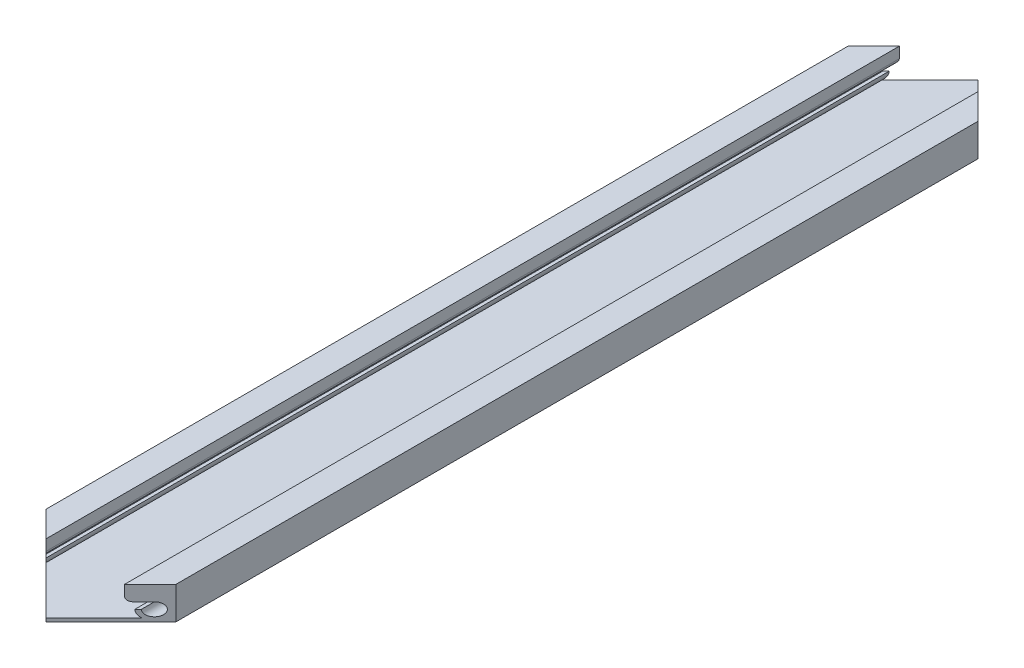
from build123d import *

# Parameters (mm, degrees)
SKETCH_1_W          = 60
SKETCH_1_H          = 15
EXTRUDE_1_DEPTH     = 430
SKETCH_2_R          = 3
CUT_EXTRUDE_1_DEPTH = 432.110484679
CUT_EXTRUDE_2_DEPTH = 432.110484679
SKETCH_4_W          = 36.3
SKETCH_4_H          = 7
CUT_EXTRUDE_3_DEPTH = 432.110484679
FILLET_1_R          = 2
CUT_EXTRUDE_4_DEPTH = 432.306155764


with BuildPart() as part:
    # 스케치1 → 보스-돌출1 (new body)
    with BuildSketch(Plane.XY):
        Rectangle(SKETCH_1_W, SKETCH_1_H)
    extrude(amount=EXTRUDE_1_DEPTH)

    # 스케치2 → 컷-돌출1 (cut, through all)
    with BuildSketch(Plane(origin=(0, 0, 0), x_dir=(-1, 0, 0), z_dir=(0, 0, -1))):
        with Locations((-25, -2.5)):
            Circle(SKETCH_2_R)
        with Locations((25, -2.5)):
            Circle(SKETCH_2_R)
    extrude(amount=-CUT_EXTRUDE_1_DEPTH, mode=Mode.SUBTRACT)

    # 스케치3 → 컷-돌출2 (cut, through all)
    with BuildSketch(Plane(origin=(0, 0, 0), x_dir=(-1, 0, 0), z_dir=(0, 0, -1))):
        with BuildLine():
            Line((-22.171572875, -6), (22.171572875, -6))
            ThreePointArc((22.171572875, -6), (20.939339828, -4.439339828), (20.5, -2.5))
            Line((20.5, -2.5), (25, -2.5))
            Line((25, -2.5), (25, 0.5))
            Line((25, 0.5), (-25, 0.5))
            Line((-25, 0.5), (-25, -2.5))
            Line((-25, -2.5), (-20.5, -2.5))
            ThreePointArc((-20.5, -2.5), (-20.939339828, -4.439339828), (-22.171572875, -6))
        make_face()
    extrude(amount=-CUT_EXTRUDE_2_DEPTH, mode=Mode.SUBTRACT)

    # 스케치4 → 컷-돌출3 (cut, through all)
    with BuildSketch(Plane(origin=(0, 0, 0), x_dir=(-1, 0, 0), z_dir=(0, 0, -1))):
        with Locations((0.006888359, 4)):
            Rectangle(SKETCH_4_W, SKETCH_4_H)
    extrude(amount=-CUT_EXTRUDE_3_DEPTH, mode=Mode.SUBTRACT)

    # 필렛1
    fillet_1_edges = [part.edges().sort_by_distance(p)[0] for p in [
        (-18.156888359, 0.5, 215),
        (18.143111641, 0.5, 215),
    ]]
    fillet(fillet_1_edges, radius=FILLET_1_R)

    # 스케치5 → 컷-돌출4 (cut, through all)
    with BuildSketch(Plane.XZ.offset(7.5)):
        Polygon((30, 430), (0, 430), (30, 400), align=None)
        Polygon((0, 430), (-30, 430), (-30, 400), align=None)
        Polygon((0, 0), (-30, 30), (-30, 0), align=None)
        Polygon((30, 30), (0, 0), (30, 0), align=None)
    extrude(amount=-CUT_EXTRUDE_4_DEPTH, mode=Mode.SUBTRACT)


solid = part.part
